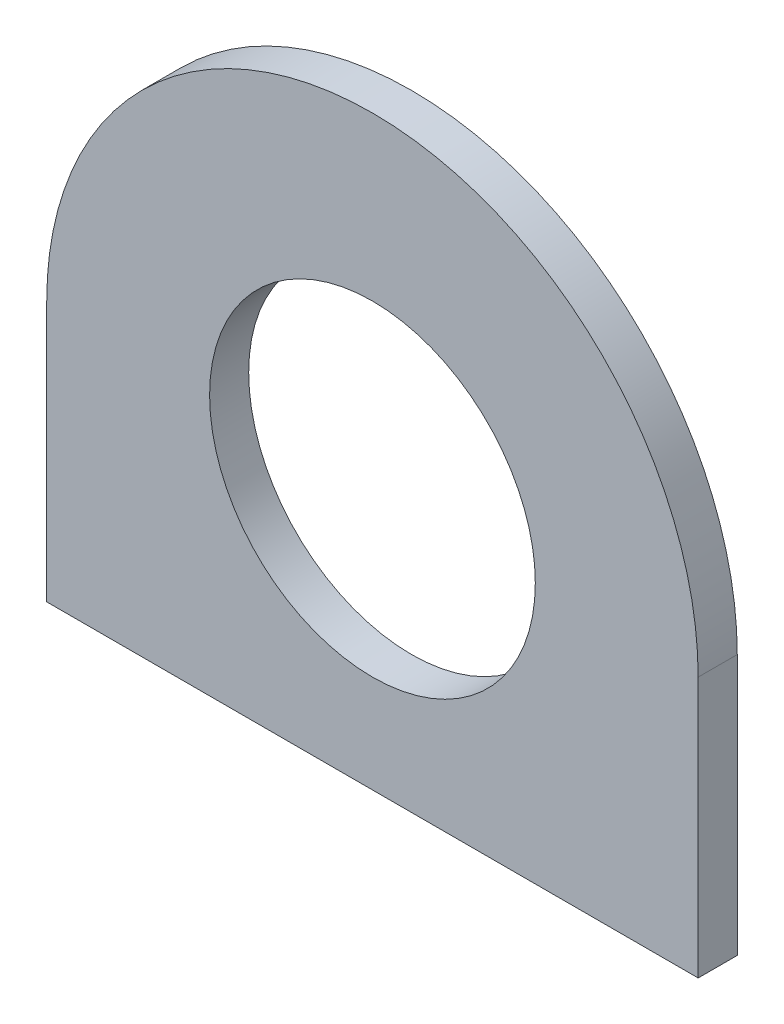
from build123d import *

# Parameters (mm, degrees)
SKETCH_1_R      = 25
EXTRUDE_1_DEPTH = 6


with BuildPart() as part:
    # Эскиз1 → Бобышка-Вытянуть1 (new body)
    with BuildSketch(Plane.XY):
        with BuildLine():
            Line((-50, 0), (-50, -40))
            Line((-50, -40), (50, -40))
            Line((50, -40), (50, 0))
            ThreePointArc((50, 0), (0, 50), (-50, 0))
        make_face()
        Circle(SKETCH_1_R, mode=Mode.SUBTRACT)
    extrude(amount=EXTRUDE_1_DEPTH)


solid = part.part
